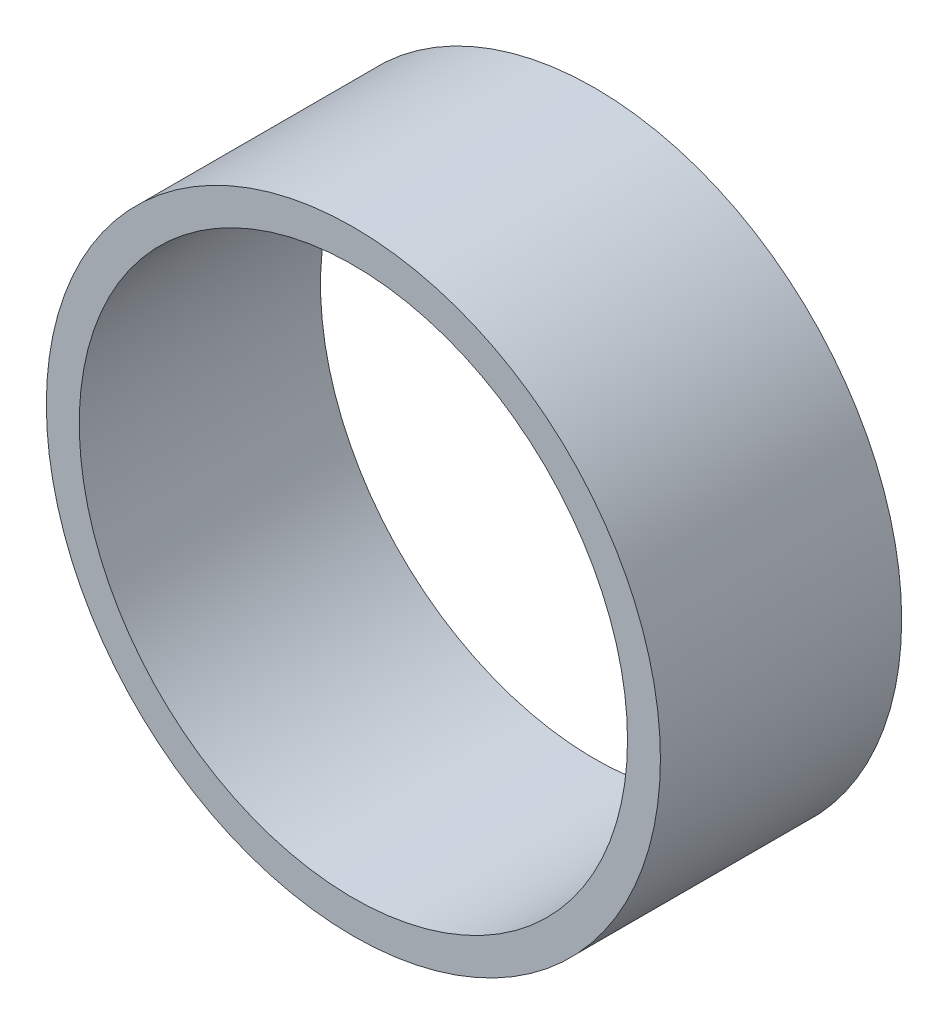
from build123d import *

# Parameters (mm, degrees)
SKETCH1_R           = 28
SKETCH1_R_2         = 25
BOSS_EXTRUDE1_DEPTH = 22


with BuildPart() as part:
    # Sketch1 → Boss-Extrude1 (new body)
    with BuildSketch(Plane.XY):
        Circle(SKETCH1_R)
        Circle(SKETCH1_R_2, mode=Mode.SUBTRACT)
    extrude(amount=BOSS_EXTRUDE1_DEPTH)


solid = part.part
